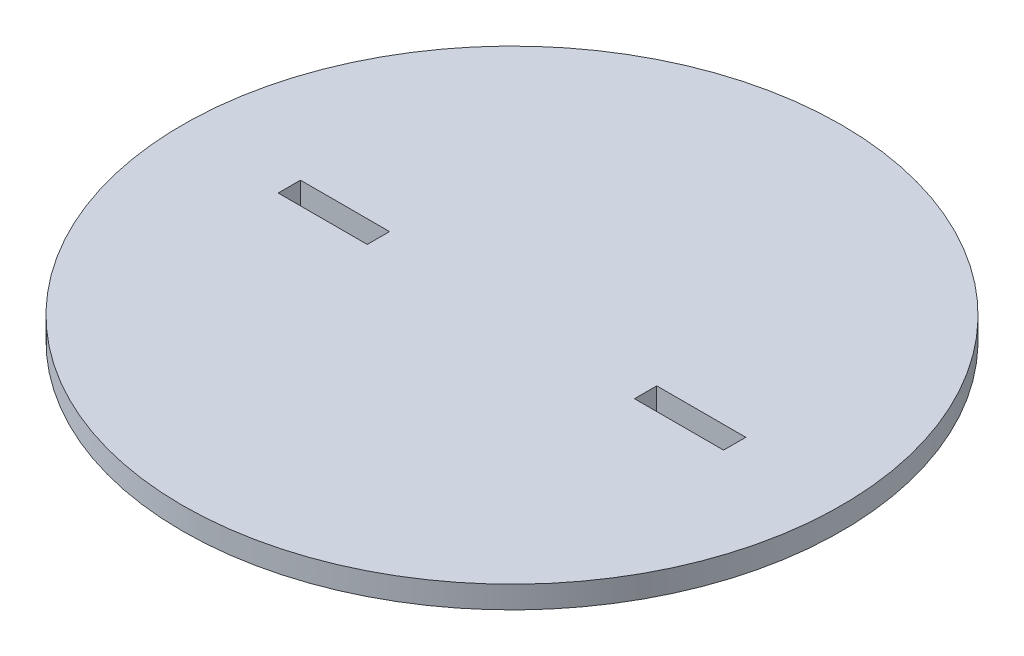
from build123d import *

# Parameters (mm, degrees)
SKETCH1_R           = 23.495
BOSS_EXTRUDE1_DEPTH = 1.5875
SKETCH2_W           = 6.35
SKETCH2_H           = 1.5875
CUT_EXTRUDE1_DEPTH  = 34.26484941


with BuildPart() as part:
    # Sketch1 → Boss-Extrude1 (new body)
    with BuildSketch(Plane(origin=(0, 0, 0), x_dir=(1, 0, 0), z_dir=(0, 1, 0))):
        with Locations(Location((0, 0, 0), (0, 0, 270))):
            Circle(SKETCH1_R)
    extrude(amount=BOSS_EXTRUDE1_DEPTH)

    # Sketch2 → Cut-Extrude1 (cut, through all)
    with BuildSketch(Plane(origin=(0, 1.5875, 0), x_dir=(1, 0, 0), z_dir=(0, 1, 0))):
        with Locations((-12.7, 0)):
            Rectangle(SKETCH2_W, SKETCH2_H)
        with Locations((12.7, 0)):
            Rectangle(SKETCH2_W, SKETCH2_H)
    extrude(amount=-CUT_EXTRUDE1_DEPTH, mode=Mode.SUBTRACT)


solid = part.part
